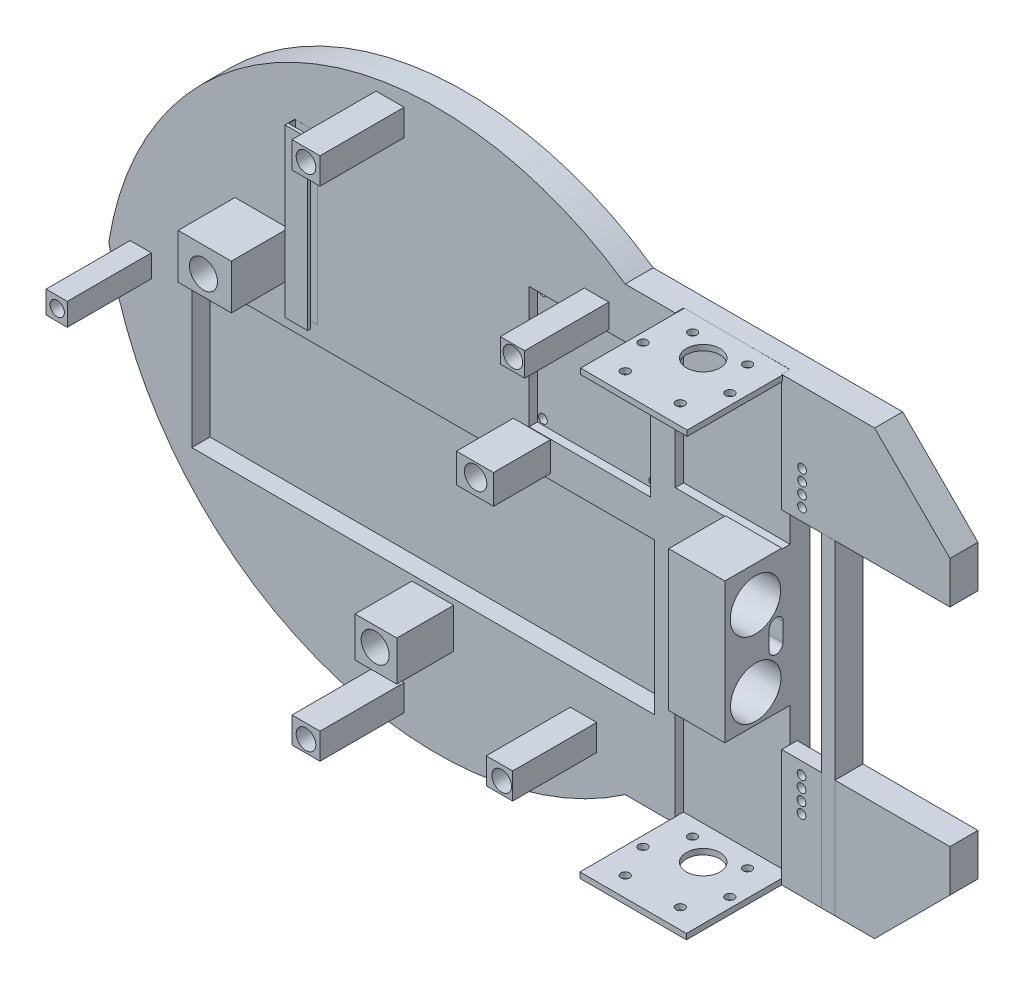
from build123d import *

# Parameters (mm, degrees)
BOSS_EXTRUDE1_DEPTH      = 10
BOSS_EXTRUDE1_DEPTH_BACK = 0.01
SKETCH3_W                = 38
SKETCH3_H                = 54
CUT_EXTRUDE1_DEPTH       = 3
SKETCH5_W                = 38
SKETCH5_H                = 54
CUT_EXTRUDE3_DEPTH       = 3
SKETCH7_W                = 165
SKETCH7_H                = 54
CUT_EXTRUDE4_DEPTH       = 6.5
SKETCH9_W                = 19
SKETCH9_H                = 16
SKETCH9_W_2              = 13.23867097
SKETCH9_H_2              = 10.44338859
SKETCH9_W_3              = 14.8958404
SKETCH9_H_3              = 14.23867097
BOSS_EXTRUDE2_DEPTH      = 20.3
SKETCH15_W               = 20
SKETCH15_H               = 50
BOSS_EXTRUDE3_DEPTH      = 20.3
SKETCH16_W               = 7.597238681
SKETCH16_H               = 8
SKETCH16_W_2             = 10
SKETCH16_H_2             = 9.4
SKETCH16_W_3             = 8.7
SKETCH16_H_3             = 8.5
SKETCH16_W_4             = 9.4
SKETCH16_H_4             = 9.3
BOSS_EXTRUDE4_DEPTH      = 30
SKETCH17_R               = 2.55
SKETCH17_R_2             = 3.5
CUT_EXTRUDE17_DEPTH      = 263.983651767
SKETCH18_W               = 43.4
SKETCH18_H               = 43.4
CUT_EXTRUDE18_DEPTH      = 3
SKETCH20_R               = 5
SKETCH20_R_2             = 4
CUT_EXTRUDE20_DEPTH      = 263.983651767
SKETCH21_R               = 9
CUT_EXTRUDE21_DEPTH      = 20
SKETCH22_R               = 1.55
CUT_EXTRUDE23_DEPTH      = 263.010307234
SKETCH25_W               = 8.1
SKETCH25_H               = 59.5
BOSS_EXTRUDE5_DEPTH      = 3.5
SKETCH26_W               = 7.81634734
SKETCH26_H               = 2.399791276
CUT_EXTRUDE24_DEPTH      = 59.5
SKETCH28_W               = 4.75290021
SKETCH28_H               = 9.947843747
BOSS_EXTRUDE6_DEPTH      = 115.870057685
SKETCH30_W               = 14.12
SKETCH30_H               = 25
CUT_EXTRUDE25_DEPTH      = 4.5
SKETCH33_R               = 1.55
CUT_EXTRUDE26_DEPTH      = 10.01
SKETCH36_W               = 38
SKETCH36_H               = 2
BOSS_EXTRUDE7_DEPTH      = 37
SKETCH39_R               = 6
SKETCH39_R_2             = 1.55
CUT_EXTRUDE28_DEPTH      = 2
SKETCH42_R               = 6
SKETCH42_R_2             = 1.55
CUT_EXTRUDE29_DEPTH      = 2


with BuildPart() as part:
    # Sketch1 → Boss-Extrude1 (new, two sides: drawn at the far end of the back side and taken through both)
    with BuildSketch(Plane.XY.offset(-BOSS_EXTRUDE1_DEPTH_BACK)):
        with BuildLine():
            Line((0, 0), (0, -37))
            Line((0, -37), (60, -37))
            Line((60, -37), (60, -52))
            Line((60, -52), (33.129942315, -78.870057685))
            Line((33.129942315, -78.870057685), (-55.850057685, -78.870057685))
            ThreePointArc((-55.850057685, -78.870057685), (-169.614041234, -90.257166815), (-239.999947532, -0.158696229))
            ThreePointArc((-239.999947532, -0.158696229), (-169.748285548, 90.207490359), (-55.850057685, 78.870057685))
            Line((-55.850057685, 78.870057685), (33.129942315, 78.870057685))
            Line((33.129942315, 78.870057685), (60, 52))
            Line((60, 52), (60, 37))
            Line((60, 37), (0, 37))
            Line((0, 37), (0, 0))
        make_face()
    extrude(amount=BOSS_EXTRUDE1_DEPTH + BOSS_EXTRUDE1_DEPTH_BACK)

    # Sketch3 → Cut-Extrude1 (cut)
    with BuildSketch(Plane.XY.offset(10)):
        with Locations((-19, 51.870057685)):
            Rectangle(SKETCH3_W, SKETCH3_H)
    extrude(amount=-CUT_EXTRUDE1_DEPTH, mode=Mode.SUBTRACT)

    # Sketch5 → Cut-Extrude3 (cut)
    with BuildSketch(Plane.XY.offset(10)):
        with Locations((-19, -51.870057685)):
            Rectangle(SKETCH5_W, SKETCH5_H)
    extrude(amount=-CUT_EXTRUDE3_DEPTH, mode=Mode.SUBTRACT)

    # Sketch7 → Cut-Extrude4 (cut)
    with BuildSketch(Plane.XY.offset(10)):
        with Locations((-127.91309413, -21.943838981)):
            Rectangle(SKETCH7_W, SKETCH7_H)
    extrude(amount=-CUT_EXTRUDE4_DEPTH, mode=Mode.SUBTRACT)

    # Sketch9 → Boss-Extrude2 (add)
    with BuildSketch(Plane.XY.offset(10)):
        with Locations((-185.5, 28)):
            Rectangle(SKETCH9_W, SKETCH9_H)
        with Locations((-89.112324575, 12.232539195)):
            Rectangle(SKETCH9_W_2, SKETCH9_H_2)
        with Locations((-124.438795754, -58.044490005)):
            Rectangle(SKETCH9_W_3, SKETCH9_H_3)
    extrude(amount=BOSS_EXTRUDE2_DEPTH)

    # Sketch15 → Boss-Extrude3 (add)
    with BuildSketch(Plane.XY.offset(10)):
        with Locations((-10, 0.20156489)):
            Rectangle(SKETCH15_W, SKETCH15_H)
    extrude(amount=BOSS_EXTRUDE3_DEPTH)

    # Sketch16 → Boss-Extrude4 (add)
    with BuildSketch(Plane.XY.offset(10)):
        with Locations((-228.62215183, 0)):
            Rectangle(SKETCH16_W, SKETCH16_H)
        with Locations((-139.68812176, 89.3492876)):
            Rectangle(SKETCH16_W_2, SKETCH16_H_2)
        with Locations((-66.02791219, 66.09880262)):
            Rectangle(SKETCH16_W_3, SKETCH16_H_3)
        with Locations((-70.67791219, -66.2732878)):
            Rectangle(SKETCH16_W_4, SKETCH16_H_4)
        with Locations((-139.68812176, -88.33151307)):
            Rectangle(SKETCH16_W_2, SKETCH16_H_4)
    extrude(amount=BOSS_EXTRUDE4_DEPTH)

    # Sketch17 → Cut-Extrude17 (cut, through all)
    with BuildSketch(Plane.XY):
        with Locations((-228.42077117, 0)):
            Circle(SKETCH17_R)
        with Locations((-139.68812176, 89.6492876)):
            Circle(SKETCH17_R_2)
        with Locations((-65.87791219, 66.34880262)):
            Circle(SKETCH17_R_2)
        with Locations((-69.87791219, -66.6232878)):
            Circle(SKETCH17_R_2)
        with Locations((-139.68812176, -88.68151307)):
            Circle(SKETCH17_R_2)
    extrude(amount=CUT_EXTRUDE17_DEPTH, mode=Mode.SUBTRACT)

    # Sketch18 → Cut-Extrude18 (cut)
    with BuildSketch(Plane.XY.offset(10)):
        with Locations((-68.42454895, 39.3)):
            Rectangle(SKETCH18_W, SKETCH18_H)
    extrude(amount=-CUT_EXTRUDE18_DEPTH, mode=Mode.SUBTRACT)

    # Sketch20 → Cut-Extrude20 (cut, through all)
    with BuildSketch(Plane.XY):
        with Locations((-185.94705048, 27.1120848)):
            Circle(SKETCH20_R)
        with Locations((-124.709385772, -57.612858016)):
            Circle(SKETCH20_R)
        with Locations((-88.8879152, 12.75038661)):
            Circle(SKETCH20_R_2)
    extrude(amount=CUT_EXTRUDE20_DEPTH, mode=Mode.SUBTRACT)

    # Sketch21 → Cut-Extrude21 (cut)
    with BuildSketch(Plane(origin=(0, 0, 0), x_dir=(0, 0, -1), z_dir=(1, 0, 0))):
        with Locations((-19.36187505, 12.37175029)):
            Circle(SKETCH21_R)
        with Locations((-19.26539558, -14.62824971)):
            Circle(SKETCH21_R)
        with BuildLine():
            Line((-9.491579533, 2.276446619), (-9.557448357, -4.178698144))
            ThreePointArc((-9.557448357, -4.178698144), (-12.081396215, -6.651657156), (-14.554355227, -4.127709299))
            Line((-14.554355227, -4.127709299), (-14.488486403, 2.327435464))
            ThreePointArc((-14.488486403, 2.327435464), (-11.964538545, 4.800394476), (-9.491579533, 2.276446619))
        make_face()
    extrude(amount=-CUT_EXTRUDE21_DEPTH, mode=Mode.SUBTRACT)

    # Sketch22 → Cut-Extrude23 (cut, through all)
    with BuildSketch(Plane.XY.offset(7)):
        with Locations((-88.16862044, 58.97947337)):
            Circle(SKETCH22_R)
        with Locations((-48.76862044, 58.97947337)):
            Circle(SKETCH22_R)
        with Locations((-48.76862044, 19.57947337)):
            Circle(SKETCH22_R)
        with Locations((-88.16862044, 19.57947337)):
            Circle(SKETCH22_R)
    extrude(amount=-CUT_EXTRUDE23_DEPTH, mode=Mode.SUBTRACT)

    # Sketch25 → Boss-Extrude5 (add)
    with BuildSketch(Plane.XY.offset(10)):
        with Locations((-169.64640613, 41.09949177)):
            Rectangle(SKETCH25_W, SKETCH25_H)
    extrude(amount=BOSS_EXTRUDE5_DEPTH)

    # Sketch26 → Cut-Extrude24 (cut)
    with BuildSketch(Plane.XZ.offset(-11.34949177)):
        with Locations((-169.5045798, 11.208428435)):
            Rectangle(SKETCH26_W, SKETCH26_H)
    extrude(amount=-CUT_EXTRUDE24_DEPTH, mode=Mode.SUBTRACT)

    # Sketch28 → Boss-Extrude6 (add)
    with BuildSketch(Plane.XZ.offset(78.870057685)):
        with Locations((16.603067585, 5.033719824)):
            Rectangle(SKETCH28_W, SKETCH28_H)
    extrude(amount=-BOSS_EXTRUDE6_DEPTH)

    # Sketch30 → Cut-Extrude25 (cut)
    with BuildSketch(Plane(origin=(0, 0, -0.01), x_dir=(-1, 0, 0), z_dir=(0, 0, -1))):
        with Locations((-7.06, -49.5)):
            Rectangle(SKETCH30_W, SKETCH30_H)
        Polygon((-14.38072485, 61.935396467), (-14.275539526, 36.935617747), (-0.155664505, 36.995026418), (-0.260849829, 61.994805138), align=None)
    extrude(amount=-CUT_EXTRUDE25_DEPTH, mode=Mode.SUBTRACT)

    # Sketch33 → Cut-Extrude26 (cut)
    with BuildSketch(Plane(origin=(0, 0, -0.01), x_dir=(-1, 0, 0), z_dir=(0, 0, -1))):
        with Locations((-7.06, -53.4)):
            Circle(SKETCH33_R)
        with Locations((-7.06, -49.4)):
            Circle(SKETCH33_R)
        with Locations((-7.06, -45.4)):
            Circle(SKETCH33_R)
        with Locations((-7.06, -41.4)):
            Circle(SKETCH33_R)
        with Locations((-7.228632788, 41.370889137)):
            Circle(SKETCH33_R)
        with Locations((-7.244931474, 45.370855931)):
            Circle(SKETCH33_R)
        with Locations((-7.261230159, 49.370822725)):
            Circle(SKETCH33_R)
        with Locations((-7.277528845, 53.370789519)):
            Circle(SKETCH33_R)
    extrude(amount=-CUT_EXTRUDE26_DEPTH, mode=Mode.SUBTRACT)

    # Sketch36 → Boss-Extrude7 (add)
    with BuildSketch(Plane.XY.offset(7)):
        Polygon((0.279518574, 78.814629504), (0.272425555, 76.814642082), (-37.727335467, 76.949409435), (-37.720242449, 78.949396858), align=None)
        with Locations((-19, -77.815125164)):
            Rectangle(SKETCH36_W, SKETCH36_H)
    extrude(amount=BOSS_EXTRUDE7_DEPTH)

    # Sketch39 → Cut-Extrude28 (cut)
    with BuildSketch(Plane.XZ.offset(78.815125164)):
        with Locations(Location((-19, 19, 0), (0, 0, 270))):
            Circle(SKETCH39_R)
        with Locations(Location((-34.499611559, 25.01055106, 0), (0, 0, 270))):
            Circle(SKETCH39_R_2)
        with Locations(Location((-3.563871147, 24.988758691, 0), (0, 0, 270))):
            Circle(SKETCH39_R_2)
        with Locations(Location((-28.819186805, 37.01055106, 0), (0, 0, 270))):
            Circle(SKETCH39_R_2)
        with Locations(Location((-9.177448314, 36.988758691, 0), (0, 0, 270))):
            Circle(SKETCH39_R_2)
        with Locations(Location((-28.819994175, 13.01055106, 0), (0, 0, 270))):
            Circle(SKETCH39_R_2)
        with Locations(Location((-9.230494356, 12.988758691, 0), (0, 0, 270))):
            Circle(SKETCH39_R_2)
    extrude(amount=-CUT_EXTRUDE28_DEPTH, mode=Mode.SUBTRACT)

    # Sketch42 → Cut-Extrude29 (cut)
    with BuildSketch(Plane(origin=(0.279518574, 78.814629504, 0), x_dir=(0.9999937111161443, -0.003546509292438372, 0), z_dir=(0.003546509292438372, 0.9999937111161443, 0))):
        with Locations(Location((-19.279713392, -19, 0), (0, 0, 180))):
            Circle(SKETCH42_R)
        with Locations(Location((-29.070149337, -13, 0), (0, 0, 180))):
            Circle(SKETCH42_R_2)
        with Locations(Location((-3.778432466, -25, 0), (0, 0, 180))):
            Circle(SKETCH42_R_2)
        with Locations(Location((-9.464104196, -13, 0), (0, 0, 180))):
            Circle(SKETCH42_R_2)
        with Locations(Location((-34.772326096, -25, 0), (0, 0, 180))):
            Circle(SKETCH42_R_2)
        with Locations(Location((-29.096493177, -37, 0), (0, 0, 180))):
            Circle(SKETCH42_R_2)
        with Locations(Location((-9.473371075, -37, 0), (0, 0, 180))):
            Circle(SKETCH42_R_2)
    extrude(amount=-CUT_EXTRUDE29_DEPTH, mode=Mode.SUBTRACT)


solid = part.part
